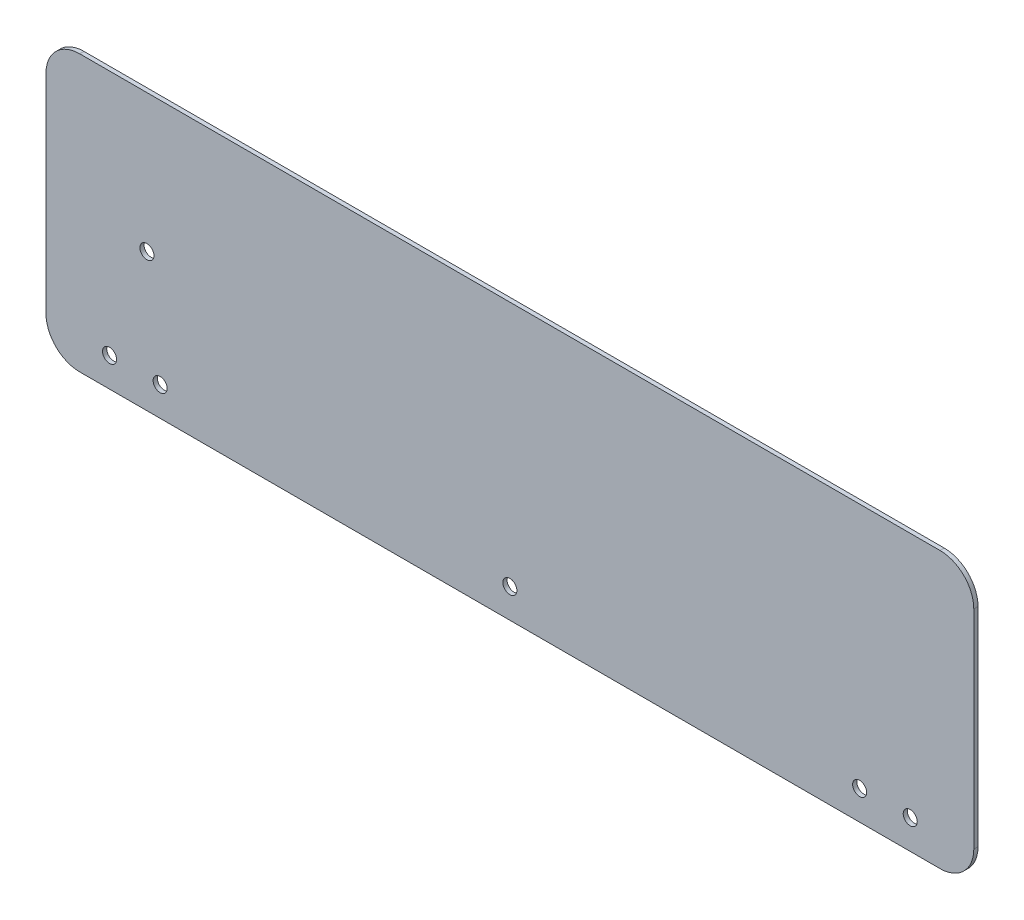
from build123d import *

# Parameters (mm, degrees)
SKETCH1_R           = 0.3175
BOSS_EXTRUDE1_DEPTH = 0.1905


with BuildPart() as part:
    # Sketch1 → Boss-Extrude1 (new body)
    with BuildSketch(Plane.XY):
        with BuildLine():
            Line((19.431, 6.223), (-19.431, 6.223))
            ThreePointArc((-19.431, 6.223), (-20.508630735, 5.776630735), (-20.955, 4.699))
            Line((-20.955, 4.699), (-20.955, -4.699))
            ThreePointArc((-20.955, -4.699), (-20.508630735, -5.776630735), (-19.431, -6.223))
            Line((-19.431, -6.223), (19.431, -6.223))
            ThreePointArc((19.431, -6.223), (20.508630735, -5.776630735), (20.955, -4.699))
            Line((20.955, -4.699), (20.955, 4.699))
            ThreePointArc((20.955, 4.699), (20.508630735, 5.776630735), (19.431, 6.223))
        make_face()
        with Locations((18.0848, -4.9022)):
            Circle(SKETCH1_R, mode=Mode.SUBTRACT)
        with Locations((15.7988, -4.9022)):
            Circle(SKETCH1_R, mode=Mode.SUBTRACT)
        with Locations((0, -4.9022)):
            Circle(SKETCH1_R, mode=Mode.SUBTRACT)
        with Locations((-16.3957, 0)):
            Circle(SKETCH1_R, mode=Mode.SUBTRACT)
        with Locations((-15.7988, -4.9022)):
            Circle(SKETCH1_R, mode=Mode.SUBTRACT)
        with Locations((-18.0848, -4.9022)):
            Circle(SKETCH1_R, mode=Mode.SUBTRACT)
    extrude(amount=-BOSS_EXTRUDE1_DEPTH)


solid = part.part
